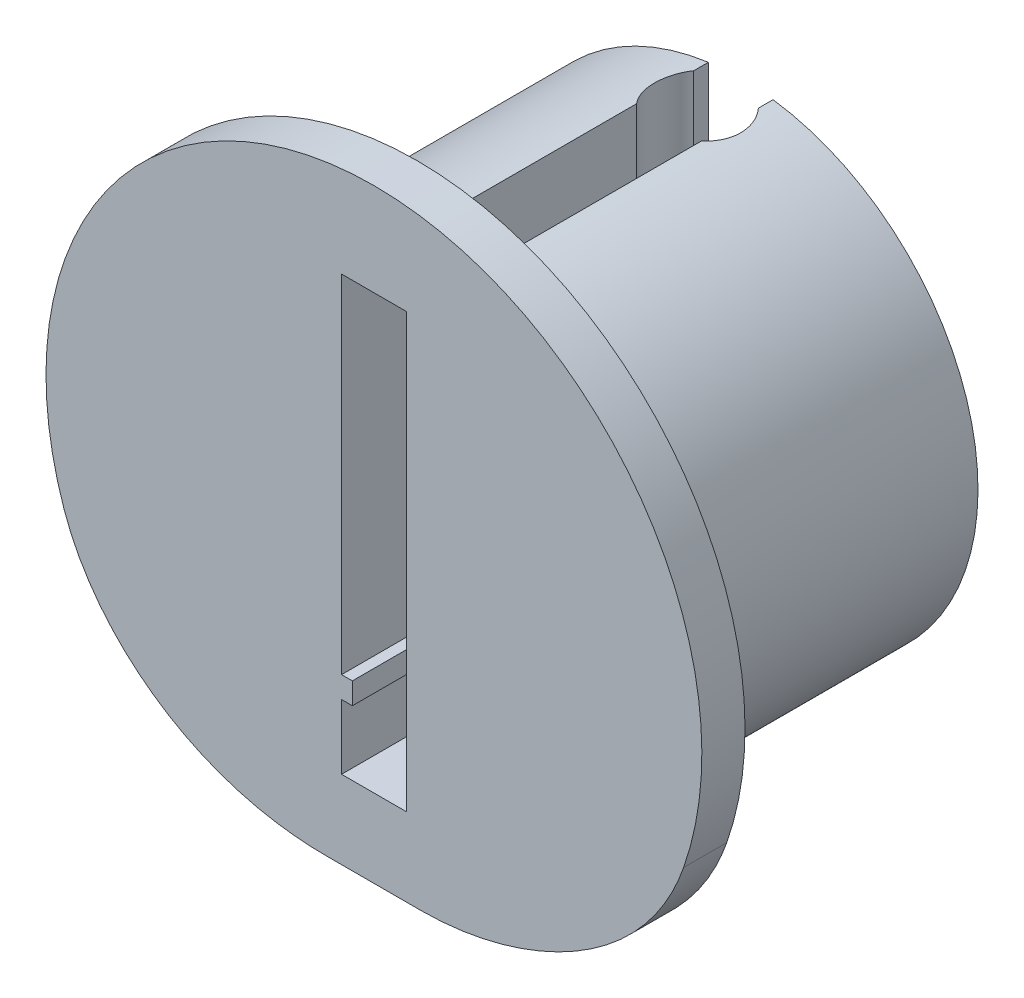
from build123d import *

# Parameters (mm, degrees)
SKETCH1_W                       = 0.5
SKETCH1_H                       = 16
SKETCH1_H_2                     = 1
SKETCH1_H_3                     = 3
BOSS_EXTRUDE1_DEPTH             = 15
SKETCH5_W                       = 2
SKETCH5_H                       = 3
CUT_EXTRUDE1_DEPTH              = 2
BOSS_EXTRUDE2_DEPTH             = 2
STICK_START                     = -2.8
STICK_OUTS_DEPTH                = 0.8
PIN_HOLE_SKETCH_R               = 2
PIN_HOLE_DEPTH                  = 5.183346
PIN_HOLE_DIRECTION_2_REACH      = 29.406
PIN_HOLE_DIRECTION_2_END_RADIUS = 11


with BuildPart() as part:
    # Sketch1 → Boss-Extrude1 (new body)
    with BuildSketch(Plane.XY):
        with BuildLine():
            Line((-2, -5.183346174), (-2, 10.816653826))
            ThreePointArc((-2, 10.816653826), (-7.03562364, -8.455767263), (11, 0))
            ThreePointArc((11, 0), (8.455767263, 7.03562364), (2, 10.816653826))
            Line((2, 10.816653826), (2, -5.183346174))
            Line((2, -5.183346174), (2, -6.183346174))
            Line((2, -6.183346174), (2, -9.183346174))
            Line((2, -9.183346174), (1.5, -9.183346174))
            Line((1.5, -9.183346174), (-1.5, -9.183346174))
            Line((-1.5, -9.183346174), (-2, -9.183346174))
            Line((-2, -9.183346174), (-2, -6.183346174))
            Line((-2, -6.183346174), (-1.5, -6.183346174))
            Line((-1.5, -6.183346174), (-1, -6.183346174))
            Line((-1, -6.183346174), (-1, -5.183346174))
            Line((-1, -5.183346174), (-1.5, -5.183346174))
            Line((-1.5, -5.183346174), (-2, -5.183346174))
        make_face()
        with Locations((1.75, 2.816653826)):
            Rectangle(SKETCH1_W, SKETCH1_H)
        with Locations((1.75, -5.683346174)):
            Rectangle(SKETCH1_W, SKETCH1_H_2)
        with Locations((1.75, -7.683346174)):
            Rectangle(SKETCH1_W, SKETCH1_H_3)
        with Locations((-1.75, -7.683346174)):
            Rectangle(SKETCH1_W, SKETCH1_H_3)
        with Locations((-1.75, 2.816653826)):
            Rectangle(SKETCH1_W, SKETCH1_H)
        with BuildLine():
            ThreePointArc((2, 10.816653826), (1.75046389, 10.859828552), (1.5, 10.897247359))
            Line((1.5, 10.897247359), (1.5, 10.816653826))
            Line((1.5, 10.816653826), (2, 10.816653826))
        make_face()
        with BuildLine():
            Line((-1.5, 10.816653826), (-1.5, 10.897247359))
            ThreePointArc((-1.5, 10.897247359), (-1.75046389, 10.859828552), (-2, 10.816653826))
            Line((-2, 10.816653826), (-1.5, 10.816653826))
        make_face()
    extrude(amount=BOSS_EXTRUDE1_DEPTH)

    # Sketch5 → Cut-Extrude1 (cut)
    with BuildSketch(Plane(origin=(0, 0, 0), x_dir=(-1, 0, 0), z_dir=(0, 0, -1))):
        with Locations((-5, 0)):
            Rectangle(SKETCH5_W, SKETCH5_H)
        with Locations((5, 0)):
            Rectangle(SKETCH5_W, SKETCH5_H)
    extrude(amount=-CUT_EXTRUDE1_DEPTH, mode=Mode.SUBTRACT)

    # Sketch3 → Boss-Extrude2 (add)
    with BuildSketch(Plane.XY.offset(15)):
        with BuildLine():
            add(Edge.make_bspline(
                [(-14.354093493, -5), (-12.863344749, -9.279669369), (-8.266658173, -12.812493902), (-2.2, -12.812493902)],
                knots=[0, 0, 0, 0, 1, 1, 1, 1], degree=3))
            ThreePointArc((-2.2, -12.812493902), (-8.103626672, -10.165197232), (-12, -5))
            Line((-12, -5), (-14.354093493, -5))
        make_face()
        with BuildLine():
            Line((-2.2, -12.812493902), (2.2, -12.812493902))
            ThreePointArc((2.2, -12.812493902), (8.103626672, -10.165197232), (12, -5))
            Line((12, -5), (9.797958971, -5))
            ThreePointArc((9.797958971, -5), (0, -11), (-9.797958971, -5))
            Line((-9.797958971, -5), (-12, -5))
            ThreePointArc((-12, -5), (-8.103626672, -10.165197232), (-2.2, -12.812493902))
        make_face()
        with BuildLine():
            ThreePointArc((12, -5), (8.103626672, -10.165197232), (2.2, -12.812493902))
            add(Edge.make_bspline(
                [(2.2, -12.812493902), (6.731876181, -12.812493902), (12.505086924, -10.308162631), (14.354093493, -5)],
                knots=[0, 0, 0, 0, 1, 1, 1, 1], degree=3))
            Line((14.354093493, -5), (12, -5))
        make_face()
        with BuildLine():
            ThreePointArc((-9.797958971, -5), (0, -11), (9.797958971, -5))
            Line((9.797958971, -5), (1.5, -5))
            Line((1.5, -5), (1.5, -9.183346174))
            Line((1.5, -9.183346174), (-1.5, -9.183346174))
            Line((-1.5, -9.183346174), (-1.5, -6.183346174))
            Line((-1.5, -6.183346174), (-1, -6.183346174))
            Line((-1, -6.183346174), (-1, -5.183346174))
            Line((-1, -5.183346174), (-1.5, -5.183346174))
            Line((-1.5, -5.183346174), (-1.5, -5))
            Line((-1.5, -5), (-9.797958971, -5))
        make_face()
        with BuildLine():
            Line((1.5, -5), (9.797958971, -5))
            ThreePointArc((9.797958971, -5), (10.695268783, -2.571230378), (11, 0))
            ThreePointArc((11, 0), (8.291561976, 7.228416147), (1.5, 10.897247359))
            Line((1.5, 10.897247359), (1.5, -5))
        make_face()
        with BuildLine():
            ThreePointArc((-1.5, 10.897247359), (-9.751491559, 5.090030685), (-9.797958971, -5))
            Line((-9.797958971, -5), (-1.5, -5))
            Line((-1.5, -5), (-1.5, 10.897247359))
        make_face()
        with BuildLine():
            Line((9.797958971, -5), (12, -5))
            ThreePointArc((12, -5), (12.747548784, -2.549509757), (13, 0))
            ThreePointArc((13, 0), (-2.549509757, 12.747548784), (-12, -5))
            Line((-12, -5), (-9.797958971, -5))
            ThreePointArc((-9.797958971, -5), (-9.751491559, 5.090030685), (-1.5, 10.897247359))
            ThreePointArc((-1.5, 10.897247359), (0, 11), (1.5, 10.897247359))
            ThreePointArc((1.5, 10.897247359), (8.291561976, 7.228416147), (11, 0))
            ThreePointArc((11, 0), (10.695268783, -2.571230378), (9.797958971, -5))
        make_face()
        with BuildLine():
            ThreePointArc((13, 0), (12.747548784, -2.549509757), (12, -5))
            Line((12, -5), (14.354093493, -5))
            ThreePointArc((14.354093493, -5), (14.987031412, -2.535525479), (15.2, 0))
            ThreePointArc((15.2, 0), (-2.535525479, 14.987031412), (-14.354093493, -5))
            Line((-14.354093493, -5), (-12, -5))
            ThreePointArc((-12, -5), (-2.549509757, 12.747548784), (13, 0))
        make_face()
        with BuildLine():
            ThreePointArc((1.5, 10.897247359), (0, 11), (-1.5, 10.897247359))
            Line((-1.5, 10.897247359), (1.5, 10.897247359))
        make_face()
    extrude(amount=BOSS_EXTRUDE2_DEPTH)

    # Sketch6 → Stick Outs (add)
    with BuildSketch(Plane.XY.offset(17).offset(STICK_START)):
        with BuildLine():
            Line((-11.719212261, -2.066413314), (-10.832885283, -1.910129954))
            ThreePointArc((-10.832885283, -1.910129954), (-10.973204553, -0.767321211), (-10.993299097, 0.383894464))
            Line((-10.993299097, 0.383894464), (-11.892750842, 0.415304011))
            ThreePointArc((-11.892750842, 0.415304011), (-11.871012198, -0.830102038), (-11.719212261, -2.066413314))
        make_face()
    stick_outs = extrude(amount=STICK_OUTS_DEPTH)

    # Mirror1: Stick Outs across plane
    add(stick_outs.mirror(Plane(origin=(0, 0, 0), x_dir=(0, 0, 1), z_dir=(1, 0, 0))))

    # Pin Hole sketch → Pin hole (cut)
    with BuildSketch(Plane(origin=(0, 0, 0), x_dir=(1, 0, 0), z_dir=(0, 1, 0))):
        with Locations((0, -2)):
            Circle(PIN_HOLE_SKETCH_R)
    extrude(amount=-PIN_HOLE_DEPTH, mode=Mode.SUBTRACT)

    # Pin hole direction 2: up to this cylinder (the profile starts inside it)
    pin_hole_direction_2_end = Plane(origin=(0, 0, 2), z_dir=(0, 0, -1)) * Cylinder(PIN_HOLE_DIRECTION_2_END_RADIUS, 81.812, mode=Mode.PRIVATE)
    # Pin Hole sketch → Pin hole direction 2 (cut, up to the surface)
    with BuildSketch(Plane(origin=(0, 0, 0), x_dir=(1, 0, 0), z_dir=(0, 1, 0)), mode=Mode.PRIVATE) as pin_hole_direction_2_sk1:
        with Locations((0, -2)):
            Circle(PIN_HOLE_SKETCH_R)
    pin_hole_direction_2_tool1 = extrude(pin_hole_direction_2_sk1.sketch, amount=PIN_HOLE_DIRECTION_2_REACH, mode=Mode.PRIVATE) & pin_hole_direction_2_end
    add(pin_hole_direction_2_tool1.solids().sort_by_distance((0, 0, 2))[0], mode=Mode.SUBTRACT)


solid = part.part
